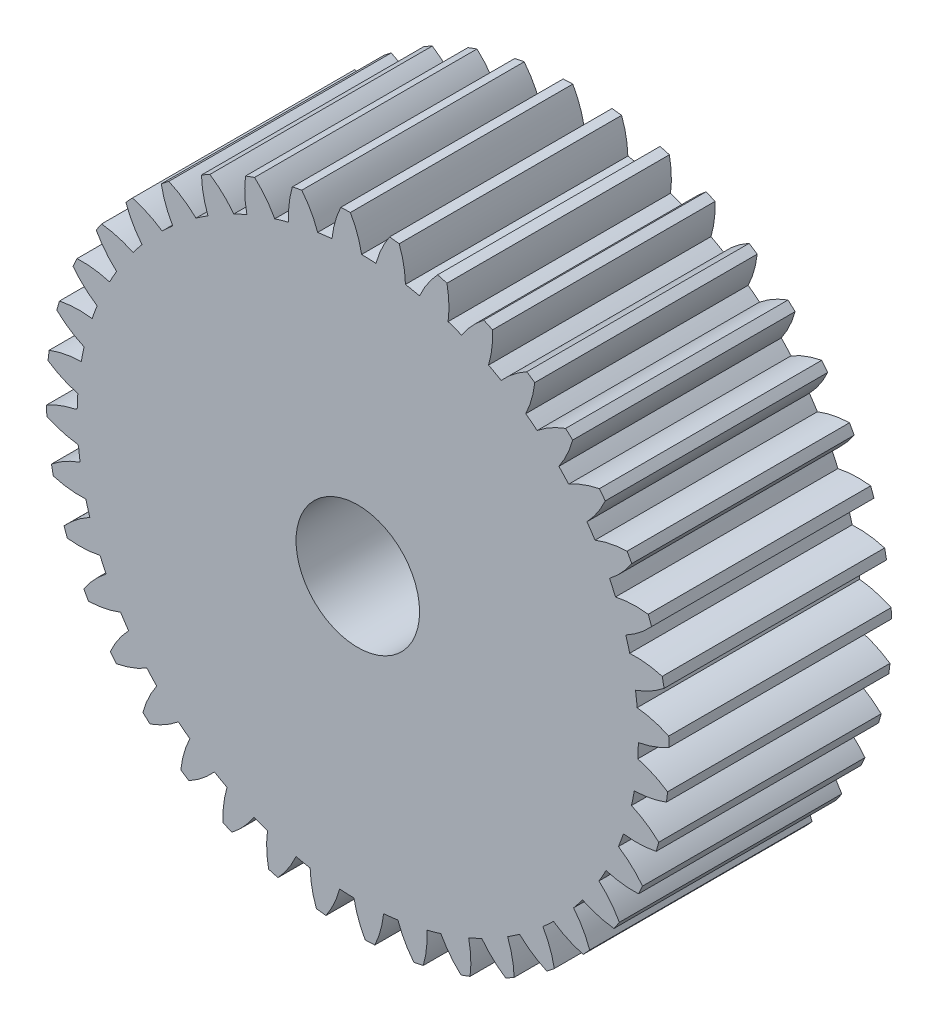
from build123d import *

# Parameters (mm, degrees)
BOSS_EXTRUDE3_DEPTH = 45
SKETCH2_R           = 56.7643875
BOSS_EXTRUDE4_DEPTH = 45
FILLET1_R           = 0.5
FILLET3_R           = 0.5
CIRPATTERN1_COUNT   = 40
SKETCH6_R           = 12.5
CUT_EXTRUDE1_DEPTH  = 45


with BuildPart() as part:
    # Sketch5 → Boss-Extrude3 (new body)
    with BuildSketch(Plane.XY):
        with BuildLine():
            ThreePointArc((-56.759152878, 0.770877963), (-59.967190395, -0.098408206), (-62.98220498, -1.497282829))
            ThreePointArc((-62.98220498, -1.497282829), (-62.951429283, -2.473368393), (-62.905527318, -3.448859644))
            ThreePointArc((-62.905527318, -3.448859644), (-59.790052579, -4.606866686), (-56.523700964, -5.221773413))
            ThreePointArc((-56.523700964, -5.221773413), (-56.720624214, -2.228559395), (-56.759152878, 0.770877963))
        make_face()
    boss_extrude3 = extrude(amount=BOSS_EXTRUDE3_DEPTH)

    # Sketch2 → Boss-Extrude4 (add)
    with BuildSketch(Plane.XY):
        Circle(SKETCH2_R)
    extrude(amount=BOSS_EXTRUDE4_DEPTH)

    # Fillet1
    fillet1_edges = [part.edges().sort_by_distance(p)[0] for p in [
        (-56.759152878, 0.770877963, 22.5),
    ]]
    fillet(fillet1_edges, radius=FILLET1_R)

    # Fillet3
    fillet3_edges = [part.edges().sort_by_distance(p)[0] for p in [
        (-56.523700964, -5.221773413, 22.5),
    ]]
    fillet(fillet3_edges, radius=FILLET3_R)

    # CirPattern1: Boss-Extrude3 ×40 about axis
    cirpattern1_axis = Axis((0, 0, 0), (0, 0, 1))
    for i in range(1, CIRPATTERN1_COUNT):
        add(boss_extrude3.rotate(cirpattern1_axis, i * 360 / CIRPATTERN1_COUNT))

    # Sketch6 → Cut-Extrude1 (cut)
    with BuildSketch(Plane.XY.offset(45)):
        Circle(SKETCH6_R)
    extrude(amount=-CUT_EXTRUDE1_DEPTH, mode=Mode.SUBTRACT)


solid = part.part
